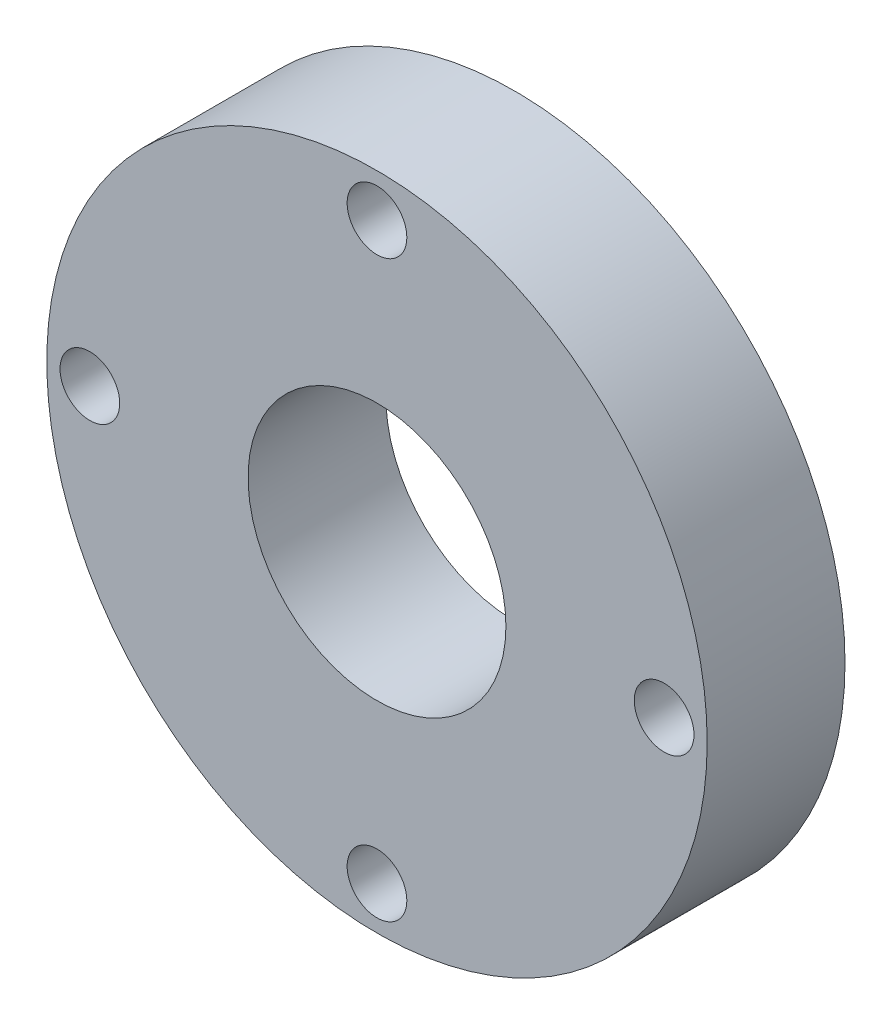
from build123d import *

# Parameters (mm, degrees)
SKETCH1_W            = 15.24
SKETCH1_H            = 26.9875
SKETCH5_R            = 14.25575
SEAL_SEAT_DEPTH      = 54.838489136
M6_CLEARANCE_HOLE1_D = 6.6
CIRPATTERN1_COUNT    = 4


with BuildPart() as part:
    # Sketch1 → Main_body (revolve)
    with BuildSketch(Plane(origin=(0, 0, 0), x_dir=(0, 0, -1), z_dir=(1, 0, 0)), mode=Mode.PRIVATE) as main_body_sk:
        with Locations((-127.089000076, -23.01875)):
            Rectangle(SKETCH1_W, SKETCH1_H)
        with Locations((-127.089000076, 23.01875)):
            Rectangle(SKETCH1_W, SKETCH1_H)
    revolve(main_body_sk.sketch.rotate(Axis((0, 0, 1000), (0, 0, -1)), 270), axis=Axis((0, 0, 1000), (0, 0, -1)))

    # Sketch5 → seal_seat (cut, through all)
    with BuildSketch(Plane.XY.offset(134.709000076)):
        Circle(SKETCH5_R)
    extrude(amount=-SEAL_SEAT_DEPTH, mode=Mode.SUBTRACT)

    # M6 Clearance Hole1 (through all)
    with Locations(Plane.XY.offset(134.709000076)):
        with Locations((0, 31.75)):
            m6_clearance_hole1 = Hole(M6_CLEARANCE_HOLE1_D / 2)

    # CirPattern1: M6 Clearance Hole1 ×4 about axis
    cirpattern1_axis = Axis((0, 0, 0), (0, 0, 1))
    for i in range(1, CIRPATTERN1_COUNT):
        add(m6_clearance_hole1.rotate(cirpattern1_axis, i * 360 / CIRPATTERN1_COUNT), mode=Mode.SUBTRACT)


solid = part.part
